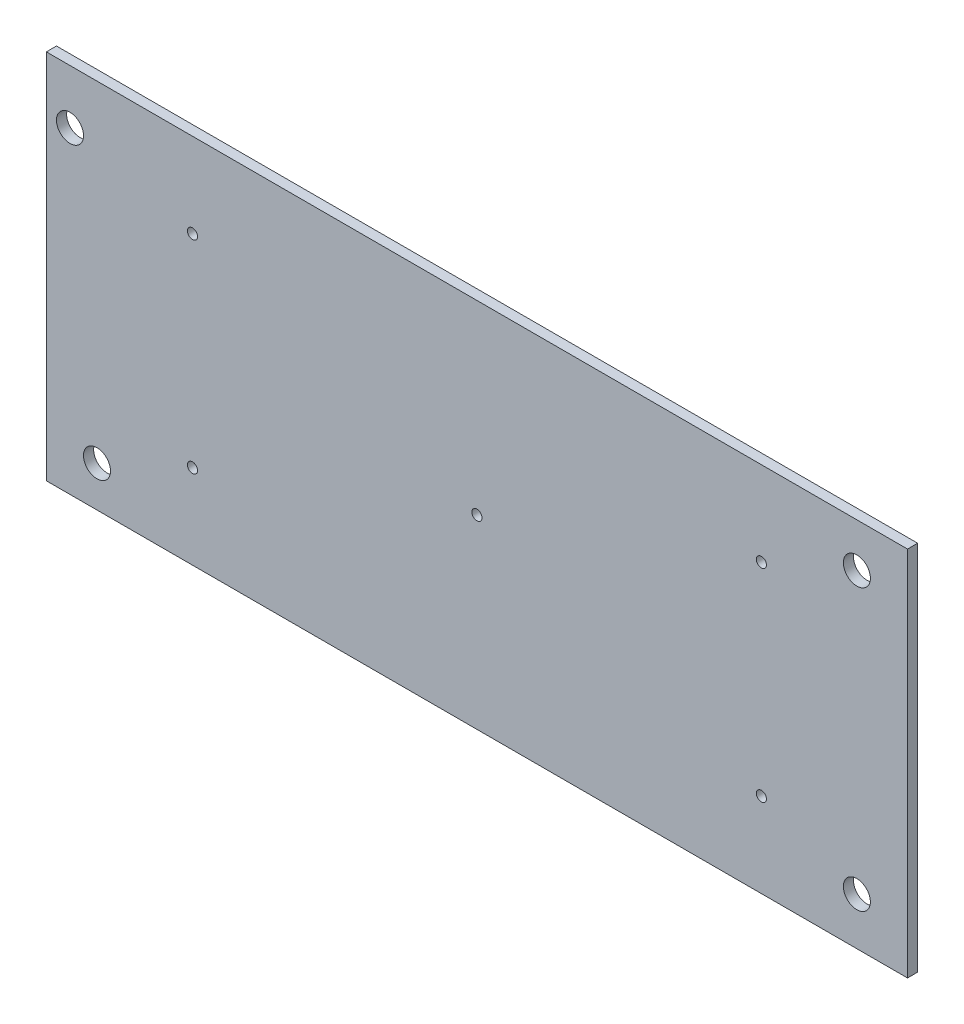
from build123d import *

# Parameters (mm, degrees)
SKETCH1_W           = 255
SKETCH1_H           = 110
SKETCH1_R           = 4
SKETCH1_R_2         = 1.5
BOSS_EXTRUDE1_DEPTH = 3


with BuildPart() as part:
    # Sketch1 → Boss-Extrude1 (new body)
    with BuildSketch(Plane.XY):
        with Locations((-13.136363636, -6.318181818)):
            Rectangle(SKETCH1_W, SKETCH1_H)
        with Locations((-125.636363636, -49.318181818)):
            Circle(SKETCH1_R, mode=Mode.SUBTRACT)
        with Locations((-133.636363636, 32.681818182)):
            Circle(SKETCH1_R, mode=Mode.SUBTRACT)
        with Locations((99.363636364, -47.318181818)):
            Circle(SKETCH1_R, mode=Mode.SUBTRACT)
        with Locations((99.363636364, 35.681818182)):
            Circle(SKETCH1_R, mode=Mode.SUBTRACT)
        with Locations((-97.369202936, 23.681818182)):
            Circle(SKETCH1_R_2, mode=Mode.SUBTRACT)
        with Locations((-97.369202936, -36.318181818)):
            Circle(SKETCH1_R_2, mode=Mode.SUBTRACT)
        with Locations(Location((71.096475664, -36.318181818, 0), (0, 0, 180))):
            Circle(SKETCH1_R_2, mode=Mode.SUBTRACT)
        with Locations(Location((71.096475664, 23.681818182, 0), (0, 0, 180))):
            Circle(SKETCH1_R_2, mode=Mode.SUBTRACT)
        with Locations((-13.136363636, -6.318181818)):
            Circle(SKETCH1_R_2, mode=Mode.SUBTRACT)
    extrude(amount=BOSS_EXTRUDE1_DEPTH)


solid = part.part
